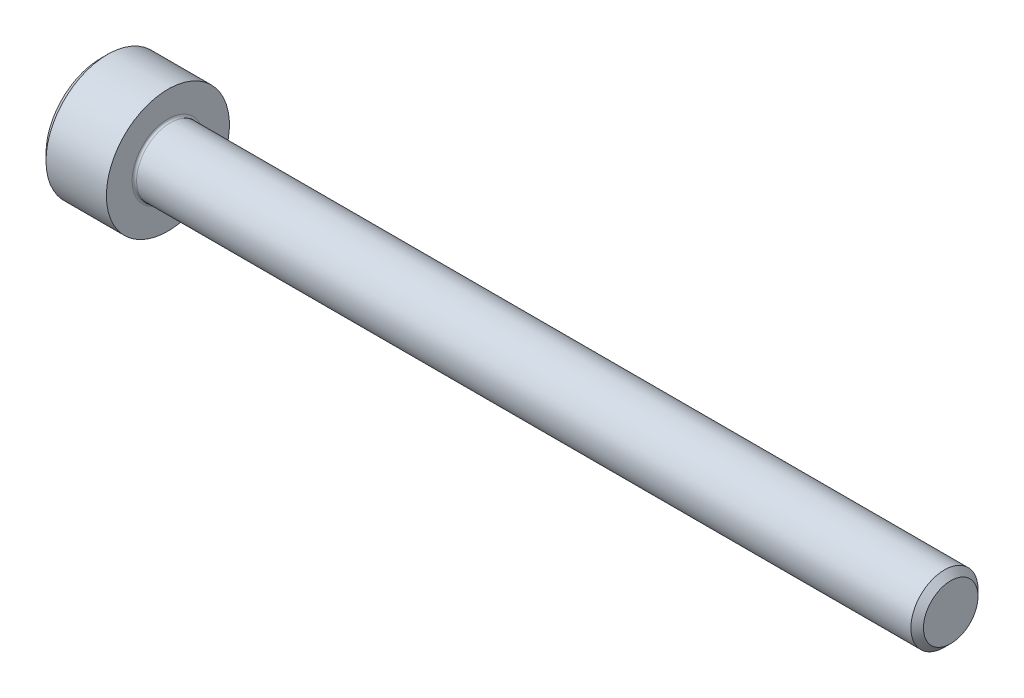
from build123d import *

# Parameters (mm, degrees)
SKETCH1_R           = 2.75
BOSS_EXTRUDE1_DEPTH = 3
SKETCH2_R           = 1.5
BOSS_EXTRUDE2_DEPTH = 35
CUT_EXTRUDE1_DEPTH  = 1.3
FILLET1_R           = 0.1
CHAMFER1_SIZE       = 0.3
CHAMFER2_SIZE       = 0.2805


with BuildPart() as part:
    # Sketch1 → Boss-Extrude1 (new body)
    with BuildSketch(Plane(origin=(3, 0, 0), x_dir=(0, 0, -1), z_dir=(1, 0, 0))):
        with Locations(Location((0, 0, 0), (0, 0, 180))):
            Circle(SKETCH1_R)
    extrude(amount=-BOSS_EXTRUDE1_DEPTH)

    # Sketch2 → Boss-Extrude2 (add)
    with BuildSketch(Plane(origin=(3, 0, 0), x_dir=(0, 0, -1), z_dir=(1, 0, 0))):
        Circle(SKETCH2_R)
    extrude(amount=BOSS_EXTRUDE2_DEPTH)

    # Sketch3 → Cut-Extrude1 (cut)
    with BuildSketch(Plane.ZY):
        Polygon((-1.28, 0.739008345), (-1.28, -0.739008345), (0, -1.478016689), (1.28, -0.739008345), (1.28, 0.739008345), (0, 1.478016689), align=None)
    extrude(amount=-CUT_EXTRUDE1_DEPTH, mode=Mode.SUBTRACT)

    # Sketch4 → Cut-Revolve1 (revolve, cut)
    with BuildSketch(Plane.XY, mode=Mode.PRIVATE) as cut_revolve1_sk:
        Polygon((1.3, 1.28), (1.3, 0), (2.039008345, 0), align=None)
    revolve(cut_revolve1_sk.sketch.rotate(Axis((1.3, 0, 0), (1, 0, 0)), 90), axis=Axis((1.3, 0, 0), (1, 0, 0)), mode=Mode.SUBTRACT)

    # Fillet1
    fillet1_edges = [part.edges().sort_by_distance(p)[0] for p in [
        (3, 0, 1.5),
    ]]
    fillet(fillet1_edges, radius=FILLET1_R)

    # Chamfer1
    chamfer1_edges = [part.edges().sort_by_distance(p)[0] for p in [
        (0, 0, -2.75),
    ]]
    chamfer(chamfer1_edges, length=CHAMFER1_SIZE)

    # Chamfer2
    chamfer2_edges = [part.edges().sort_by_distance(p)[0] for p in [
        (38, 0, 1.5),
    ]]
    chamfer(chamfer2_edges, length=CHAMFER2_SIZE)


solid = part.part
